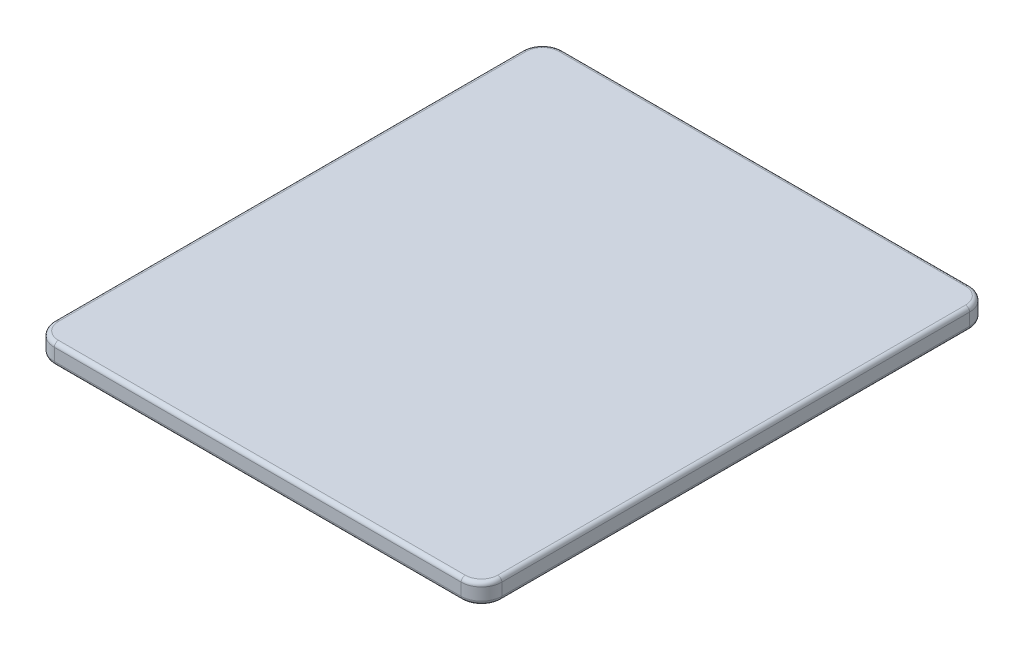
from build123d import *

# Parameters (mm, degrees)
SKETCH1_W           = 11
SKETCH1_H           = 12.5
BOSS_EXTRUDE1_DEPTH = 0.5
FILLET1_R           = 0.5
FILLET2_R           = 0.1


with BuildPart() as part:
    # Sketch1 → Boss-Extrude1 (new body)
    with BuildSketch(Plane(origin=(0, 0, 0), x_dir=(1, 0, 0), z_dir=(0, 1, 0))):
        Rectangle(SKETCH1_W, SKETCH1_H)
    extrude(amount=BOSS_EXTRUDE1_DEPTH)

    # Fillet1
    fillet1_edges = [part.edges().sort_by_distance(p)[0] for p in [
        (-5.5, 0.25, -6.25),
        (5.5, 0.25, -6.25),
        (5.5, 0.25, 6.25),
        (-5.5, 0.25, 6.25),
    ]]
    fillet(fillet1_edges, radius=FILLET1_R)

    # Fillet2
    fillet2_edges = [part.edges().sort_by_distance(p)[0] for p in [
        (-5.5, 0, 0),
        (-5.5, 0.5, 0),
        (0, 0, -6.25),
        (5.5, 0, 0),
        (0, 0, 6.25),
        (5.353553391, 0, 6.103553391),
        (-5.353553391, 0, 6.103553391),
        (5.353553391, 0, -6.103553391),
        (-5.353553391, 0, -6.103553391),
        (0, 0.5, -6.25),
        (0, 0.5, 6.25),
        (5.5, 0.5, 0),
        (5.353553391, 0.5, 6.103553391),
        (-5.353553391, 0.5, 6.103553391),
        (5.353553391, 0.5, -6.103553391),
        (-5.353553391, 0.5, -6.103553391),
    ]]
    fillet(fillet2_edges, radius=FILLET2_R)


solid = part.part
